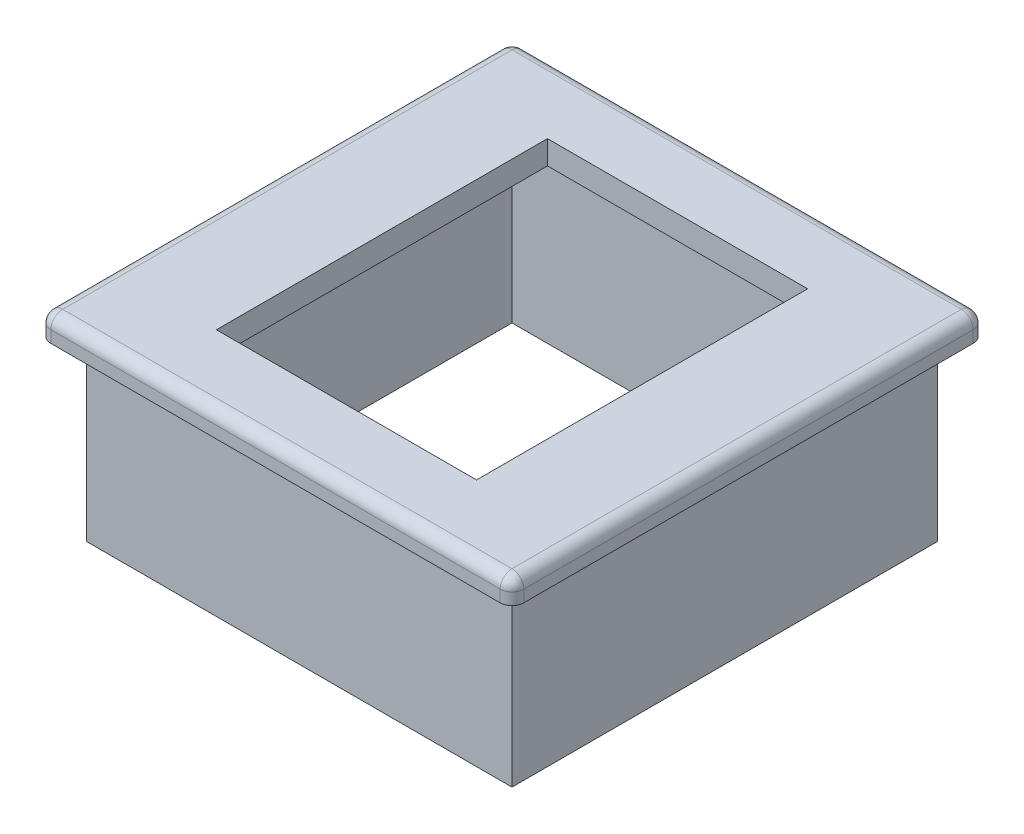
from build123d import *

# Parameters (mm, degrees)
SKETCH1_W           = 40
SKETCH1_H           = 40
SKETCH1_W_2         = 22
SKETCH1_H_2         = 28
BOSS_EXTRUDE1_DEPTH = 2
SKETCH2_W           = 36
SKETCH2_H           = 36
SKETCH2_W_2         = 32
SKETCH2_H_2         = 32
BOSS_EXTRUDE2_DEPTH = 15
FILLET1_R           = 1


with BuildPart() as part:
    # Sketch1 → Boss-Extrude1 (new body)
    with BuildSketch(Plane(origin=(0, 0, 0), x_dir=(1, 0, 0), z_dir=(0, 1, 0))):
        Rectangle(SKETCH1_W, SKETCH1_H)
        Rectangle(SKETCH1_W_2, SKETCH1_H_2, mode=Mode.SUBTRACT)
    extrude(amount=BOSS_EXTRUDE1_DEPTH)

    # Sketch2 → Boss-Extrude2 (add)
    with BuildSketch(Plane(origin=(0, 0, 0), x_dir=(-1, 0, 0), z_dir=(0, -1, 0))):
        Rectangle(SKETCH2_W, SKETCH2_H)
        Rectangle(SKETCH2_W_2, SKETCH2_H_2, mode=Mode.SUBTRACT)
    extrude(amount=BOSS_EXTRUDE2_DEPTH)

    # Fillet1
    fillet1_edges = [part.edges().sort_by_distance(p)[0] for p in [
        (-20, 2, 0),
        (0, 2, 20),
        (20, 2, 0),
        (0, 2, -20),
        (20, 1, 20),
        (-20, 1, 20),
        (-20, 1, -20),
        (20, 1, -20),
    ]]
    fillet(fillet1_edges, radius=FILLET1_R)


solid = part.part
